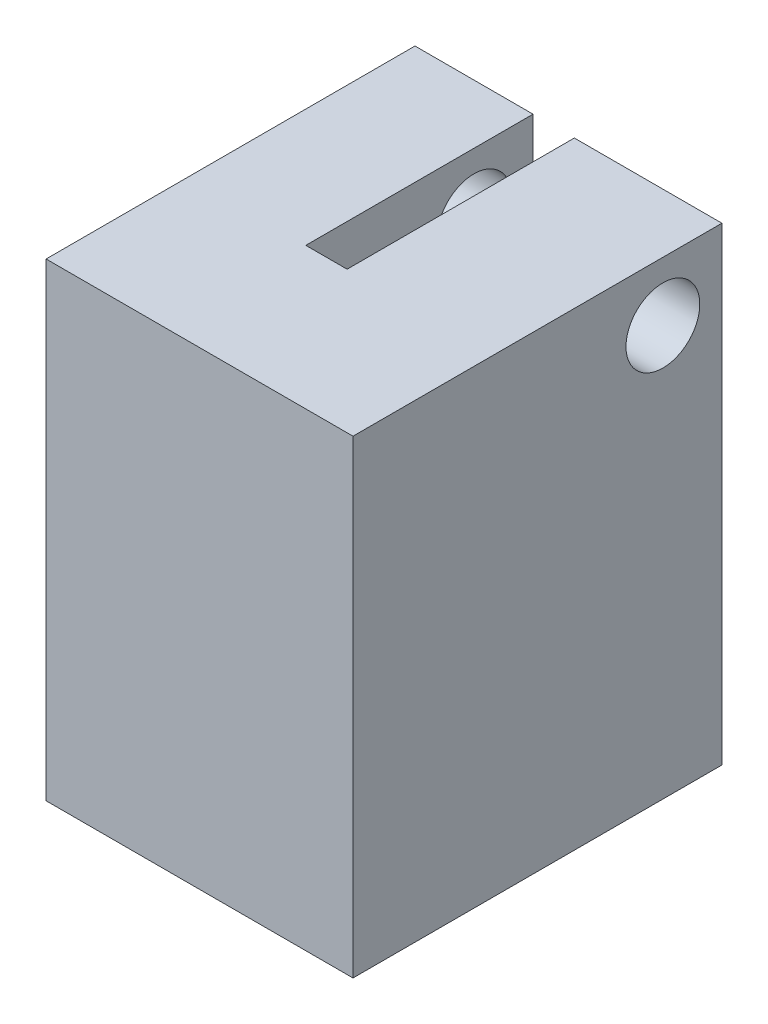
from build123d import *

# Parameters (mm, degrees)
SKETCH1_W           = 15.875
SKETCH1_H           = 20.193
SKETCH1_R           = 1.5875
BOSS_EXTRUDE1_DEPTH = 13.208
SKETCH4_W           = 1.778
SKETCH4_H           = 20.193
CUT_EXTRUDE1_DEPTH  = 9.779


with BuildPart() as part:
    # Sketch1 → Boss-Extrude1 (new body)
    with BuildSketch(Plane(origin=(0, 0, 0), x_dir=(0, 0, -1), z_dir=(1, 0, 0))):
        with Locations((7.9375, 10.0965)):
            Rectangle(SKETCH1_W, SKETCH1_H)
        with Locations(Location((13.335, 17.653, 0), (0, 0, 180))):
            Circle(SKETCH1_R, mode=Mode.SUBTRACT)
    extrude(amount=BOSS_EXTRUDE1_DEPTH)

    # Sketch4 → Cut-Extrude1 (cut)
    with BuildSketch(Plane(origin=(0, 0, -15.875), x_dir=(-1, 0, 0), z_dir=(0, 0, -1))):
        with Locations((-5.969, 10.0965)):
            Rectangle(SKETCH4_W, SKETCH4_H)
    extrude(amount=-CUT_EXTRUDE1_DEPTH, mode=Mode.SUBTRACT)


solid = part.part
